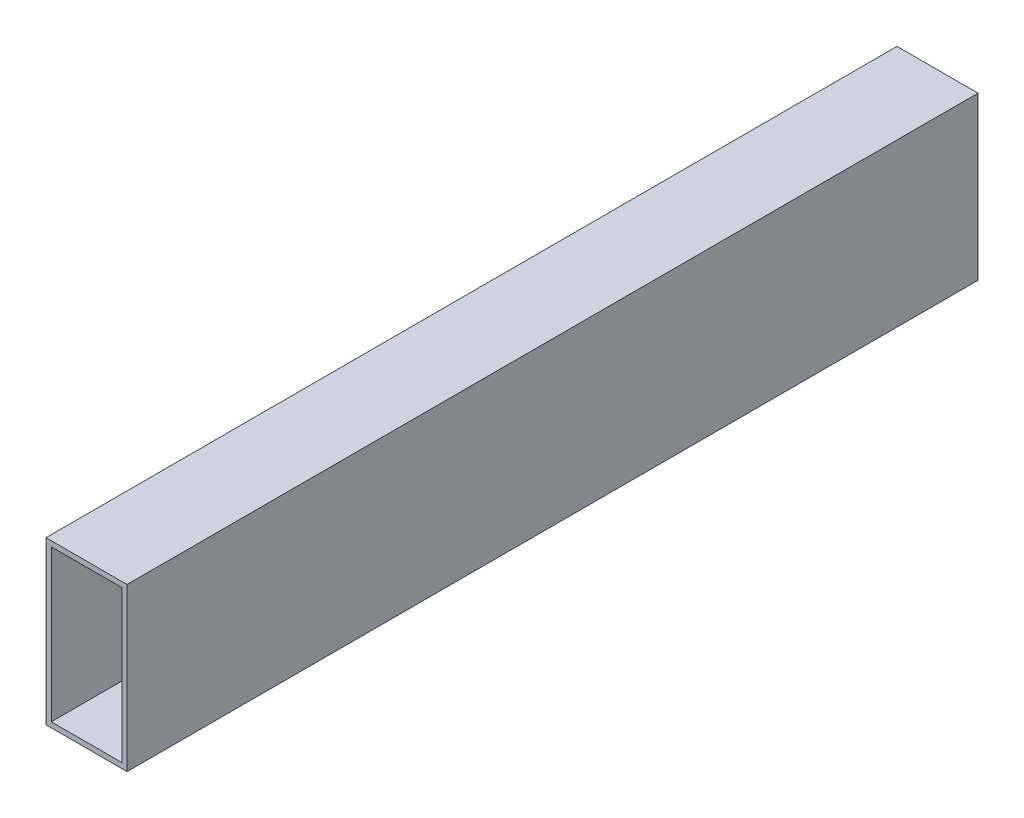
from build123d import *

# Parameters (mm, degrees)
SKETCH1_W           = 25.4
SKETCH1_H           = 50.8
BOSS_EXTRUDE1_DEPTH = 266.7
SKETCH2_W           = 22.098
SKETCH2_H           = 47.498
CUT_EXTRUDE1_DEPTH  = 274.865908674


with BuildPart() as part:
    # Sketch1 → Boss-Extrude1 (new body)
    with BuildSketch(Plane.XY):
        with Locations((-40.17672956, -7.428301887)):
            Rectangle(SKETCH1_W, SKETCH1_H)
    extrude(amount=BOSS_EXTRUDE1_DEPTH)

    # Sketch2 → Cut-Extrude1 (cut, through all)
    with BuildSketch(Plane.XY.offset(266.7)):
        with Locations((-40.17672956, -7.428301887)):
            Rectangle(SKETCH2_W, SKETCH2_H)
    extrude(amount=-CUT_EXTRUDE1_DEPTH, mode=Mode.SUBTRACT)


solid = part.part
